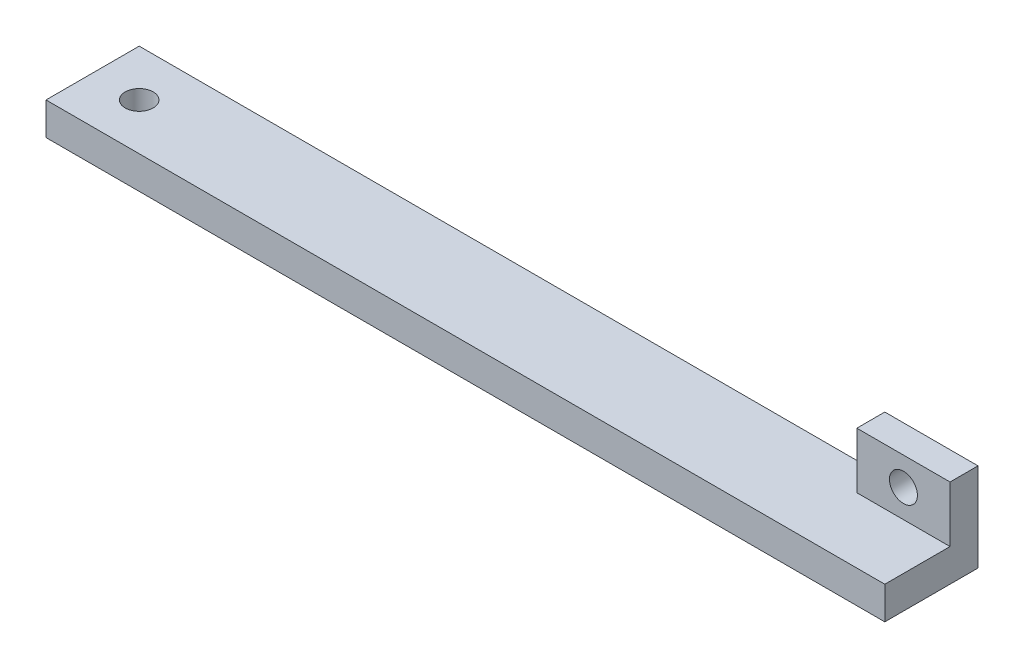
from build123d import *

# Parameters (mm, degrees)
SKETCH1_W           = 90
SKETCH1_H           = 10
SKETCH1_R           = 1.5
BOSS_EXTRUDE1_DEPTH = 3.5
SKETCH2_W           = 10
SKETCH2_H           = 3
BOSS_EXTRUDE2_DEPTH = 6
SKETCH3_R           = 1.5
CUT_EXTRUDE1_DEPTH  = 3


with BuildPart() as part:
    # Sketch1 → Boss-Extrude1 (new body)
    with BuildSketch(Plane(origin=(0, 0, 0), x_dir=(1, 0, 0), z_dir=(0, 1, 0))):
        Rectangle(SKETCH1_W, SKETCH1_H)
        with Locations(Location((-40, 0, 0), (0, 0, 270))):
            Circle(SKETCH1_R, mode=Mode.SUBTRACT)
    extrude(amount=BOSS_EXTRUDE1_DEPTH)

    # Sketch2 → Boss-Extrude2 (add)
    with BuildSketch(Plane(origin=(0, 3.5, 0), x_dir=(1, 0, 0), z_dir=(0, 1, 0))):
        with Locations((40, 3.5)):
            Rectangle(SKETCH2_W, SKETCH2_H)
    extrude(amount=BOSS_EXTRUDE2_DEPTH)

    # Sketch3 → Cut-Extrude1 (cut)
    with BuildSketch(Plane.XY.offset(-2)):
        with Locations((40, 6.5)):
            Circle(SKETCH3_R)
    extrude(amount=-CUT_EXTRUDE1_DEPTH, mode=Mode.SUBTRACT)


solid = part.part
